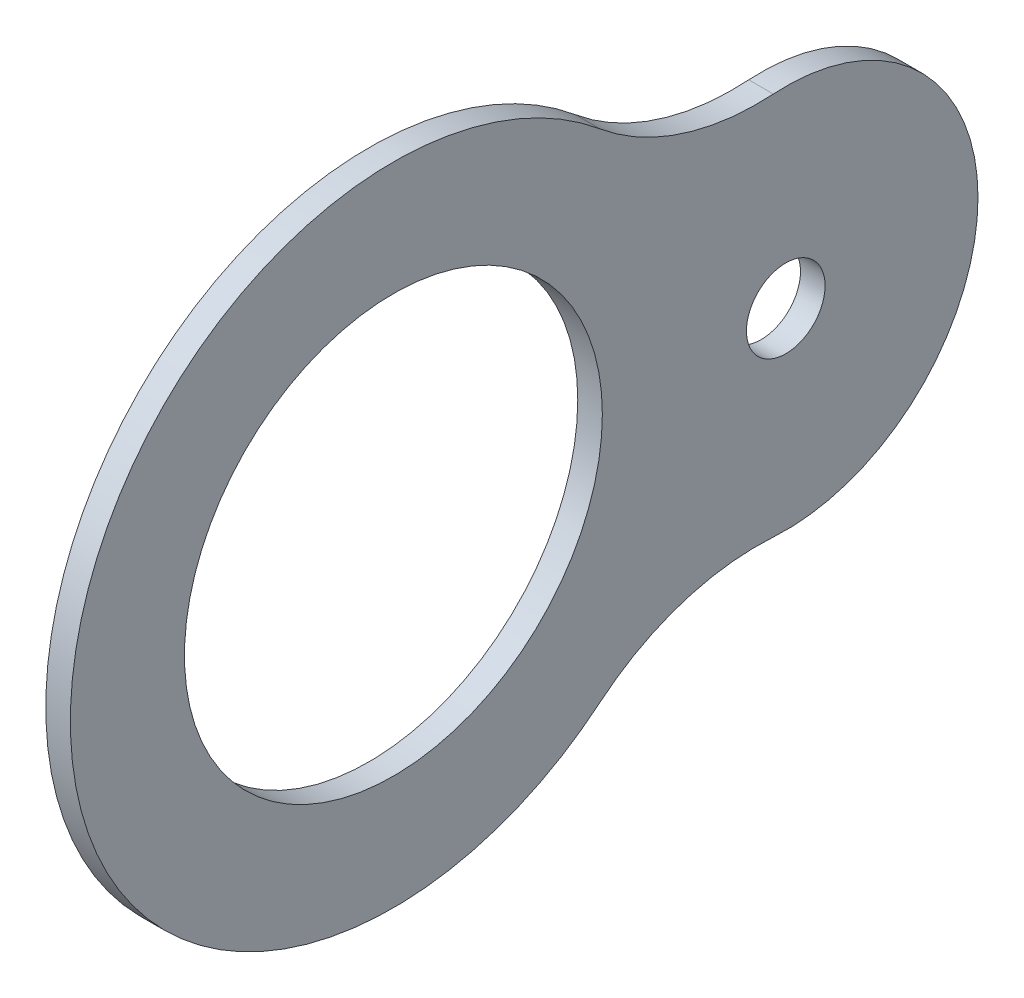
from build123d import *

# Parameters (mm, degrees)
SKETCH_1_R      = 8.5
SKETCH_1_R_2    = 1.6
EXTRUDE_1_DEPTH = 1
FILLET_1_R      = 10


with BuildPart() as part:
    # Эскиз1 → Бобышка-Вытянуть1 (new body)
    with BuildSketch(Plane(origin=(0, 0, 0), x_dir=(0, 0, -1), z_dir=(1, 0, 0))):
        with BuildLine():
            ThreePointArc((11.473333333, -6.404859266), (23.78, 0), (11.473333333, 6.404859266))
            ThreePointArc((11.473333333, 6.404859266), (-13.14, 0), (11.473333333, -6.404859266))
        make_face()
        Circle(SKETCH_1_R, mode=Mode.SUBTRACT)
        with Locations((15.96, 0)):
            Circle(SKETCH_1_R_2, mode=Mode.SUBTRACT)
    extrude(amount=EXTRUDE_1_DEPTH)

    # Скругление1
    fillet_1_edges = [part.edges().sort_by_distance(p)[0] for p in [
        (0.5, -6.404859266, -11.473333333),
        (0.5, 6.404859266, -11.473333333),
    ]]
    fillet(fillet_1_edges, radius=FILLET_1_R)


solid = part.part
